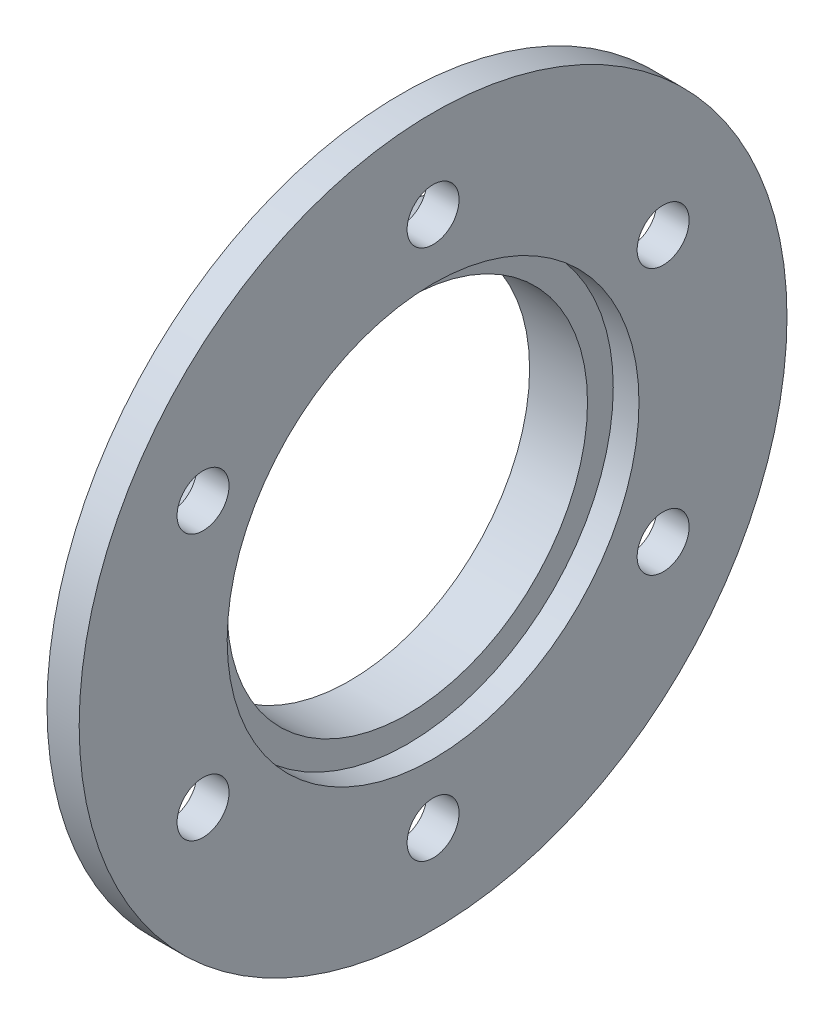
from build123d import *

# Parameters (mm, degrees)
SKETCH1_R           = 27.5
SKETCH1_R_2         = 2.0193
BOSS_EXTRUDE1_DEPTH = 2.5
SKETCH2_R           = 17.46
BOSS_EXTRUDE2_DEPTH = 4
CHAMFER5_SIZE       = 1
SKETCH6_R           = 14
CUT_EXTRUDE1_DEPTH  = 10
SKETCH9_R           = 16
CUT_EXTRUDE2_DEPTH  = 2


with BuildPart() as part:
    # Sketch1 → Boss-Extrude1 (new body)
    with BuildSketch(Plane(origin=(0, 0, 0), x_dir=(0, 0, -1), z_dir=(1, 0, 0))):
        Circle(SKETCH1_R)
        with Locations((0, 20.64)):
            Circle(SKETCH1_R_2, mode=Mode.SUBTRACT)
        with Locations((17.874764334, 10.32)):
            Circle(SKETCH1_R_2, mode=Mode.SUBTRACT)
        with Locations((17.874764334, -10.32)):
            Circle(SKETCH1_R_2, mode=Mode.SUBTRACT)
        with Locations((0, -20.64)):
            Circle(SKETCH1_R_2, mode=Mode.SUBTRACT)
        with Locations((-17.874764334, -10.32)):
            Circle(SKETCH1_R_2, mode=Mode.SUBTRACT)
        with Locations((-17.874764334, 10.32)):
            Circle(SKETCH1_R_2, mode=Mode.SUBTRACT)
    extrude(amount=BOSS_EXTRUDE1_DEPTH)

    # Sketch2 → Boss-Extrude2 (add)
    with BuildSketch(Plane.ZY):
        with Locations(Location((0, 0, 0), (0, 0, 180))):
            Circle(SKETCH2_R)
    extrude(amount=BOSS_EXTRUDE2_DEPTH)

    # Chamfer5
    chamfer5_edges = [part.edges().sort_by_distance(p)[0] for p in [
        (-4, 0, 17.46),
    ]]
    chamfer(chamfer5_edges, length=CHAMFER5_SIZE)

    # Sketch6 → Cut-Extrude1 (cut)
    with BuildSketch(Plane(origin=(-4, 0, 0), x_dir=(0, 0, -1), z_dir=(1, 0, 0))):
        Circle(SKETCH6_R)
    extrude(amount=CUT_EXTRUDE1_DEPTH, mode=Mode.SUBTRACT)

    # Sketch9 → Cut-Extrude2 (cut)
    with BuildSketch(Plane(origin=(2.5, 0, 0), x_dir=(0, 0, -1), z_dir=(1, 0, 0))):
        Circle(SKETCH9_R)
    extrude(amount=-CUT_EXTRUDE2_DEPTH, mode=Mode.SUBTRACT)


solid = part.part
